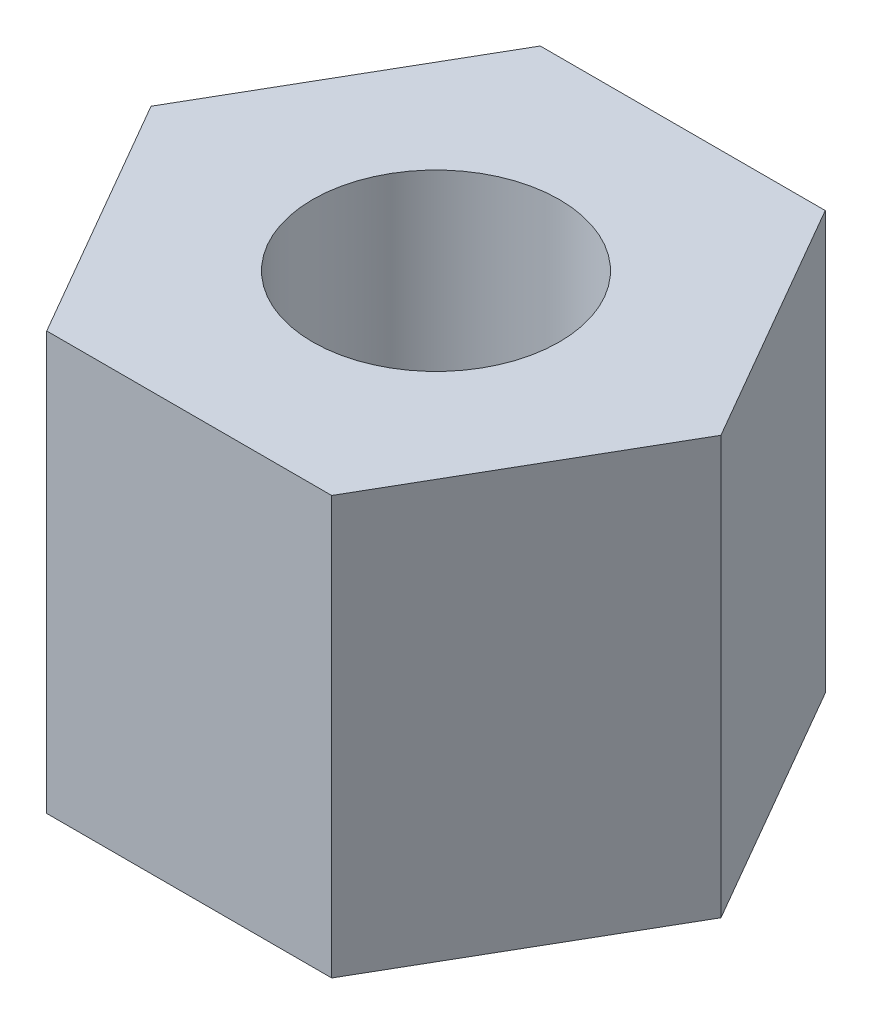
from build123d import *

# Parameters (mm, degrees)
SKETCH1_R           = 1.5
BOSS_EXTRUDE1_DEPTH = 2.54


with BuildPart() as part:
    # Sketch1 → Boss-Extrude1 (new, symmetric)
    with BuildSketch(Plane(origin=(0, 0, 0), x_dir=(1, 0, 0), z_dir=(0, 1, 0))):
        Polygon((-1.732050808, -3), (1.732050808, -3), (3.464101615, 0), (1.732050808, 3), (-1.732050808, 3), (-3.464101615, 0), align=None)
        with Locations(Location((0, 0, 0), (0, 0, 270))):
            Circle(SKETCH1_R, mode=Mode.SUBTRACT)
    extrude(amount=BOSS_EXTRUDE1_DEPTH, both=True)


solid = part.part
